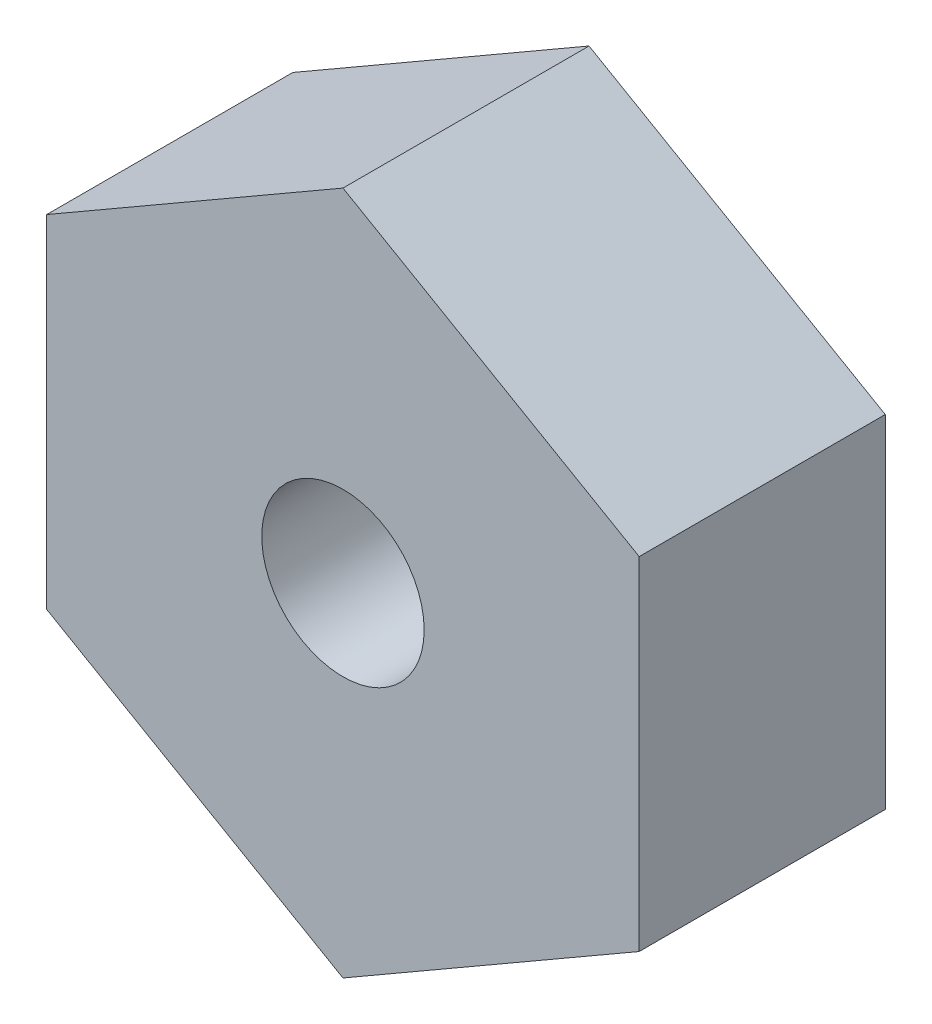
from build123d import *

# Parameters (mm, degrees)
BOSS_EXTRUDE1_DEPTH = 5
SKETCH2_R           = 1.65
CUT_EXTRUDE1_DEPTH  = 10


with BuildPart() as part:
    # Sketch1 → Boss-Extrude1 (new body)
    with BuildSketch(Plane.XY):
        Polygon((0, -6.95), (6.018876556, -3.475), (6.018876556, 3.475), (0, 6.95), (-6.018876556, 3.475), (-6.018876556, -3.475), align=None)
    extrude(amount=BOSS_EXTRUDE1_DEPTH)

    # Sketch2 → Cut-Extrude1 (cut)
    with BuildSketch(Plane.XY.offset(5)):
        Circle(SKETCH2_R)
    extrude(amount=-CUT_EXTRUDE1_DEPTH, mode=Mode.SUBTRACT)


solid = part.part
